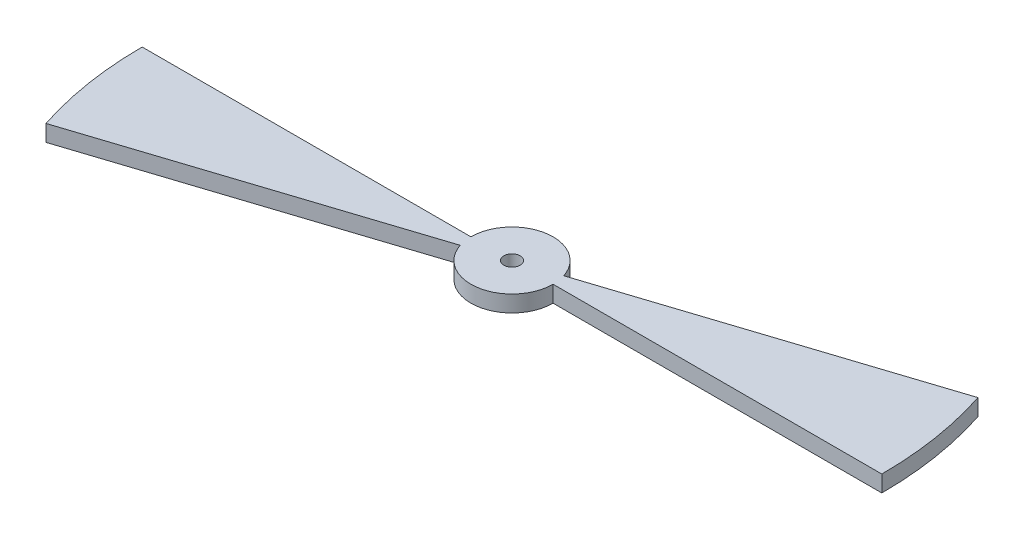
from build123d import *

# Parameters (mm, degrees)
SKETCH_1_R      = 2.5
SKETCH_1_R_2    = 0.5
EXTRUDE_1_DEPTH = 1


with BuildPart() as part:
    # 草图1 → 凸台-拉伸1 (new body)
    # profile 1 of 3: a face of its own
    with BuildSketch(Plane(origin=(0, 0, 0), x_dir=(1, 0, 0), z_dir=(0, 1, 0))):
        with BuildLine():
            Line((-21.398771617, -6.952882373), (-2.377641291, -0.772542486))
            ThreePointArc((-2.377641291, -0.772542486), (-2.469220851, -0.391086163), (-2.5, 0))
            Line((-2.5, 0), (-22.5, 0))
            ThreePointArc((-22.5, 0), (-22.222987663, -3.519775463), (-21.398771617, -6.952882373))
        make_face()
    # profile 2 of 3: a face of its own
    with BuildSketch(Plane(origin=(0, 0, 0), x_dir=(1, 0, 0), z_dir=(0, 1, 0))):
        with BuildLine():
            ThreePointArc((2.377641291, 0.772542486), (2.469220851, 0.391086163), (2.5, 0))
            Line((2.5, 0), (22.5, 0))
            ThreePointArc((22.5, 0), (22.222987663, 3.519775463), (21.398771617, 6.952882373))
            Line((21.398771617, 6.952882373), (2.377641291, 0.772542486))
        make_face()
    # profile 3 of 3: a face of its own
    with BuildSketch(Plane(origin=(0, 0, 0), x_dir=(1, 0, 0), z_dir=(0, 1, 0))):
        Circle(SKETCH_1_R)
        with Locations(Location((0, 0, 0), (0, 0, 270))):
            Circle(SKETCH_1_R_2, mode=Mode.SUBTRACT)
    extrude(amount=EXTRUDE_1_DEPTH)


solid = part.part
